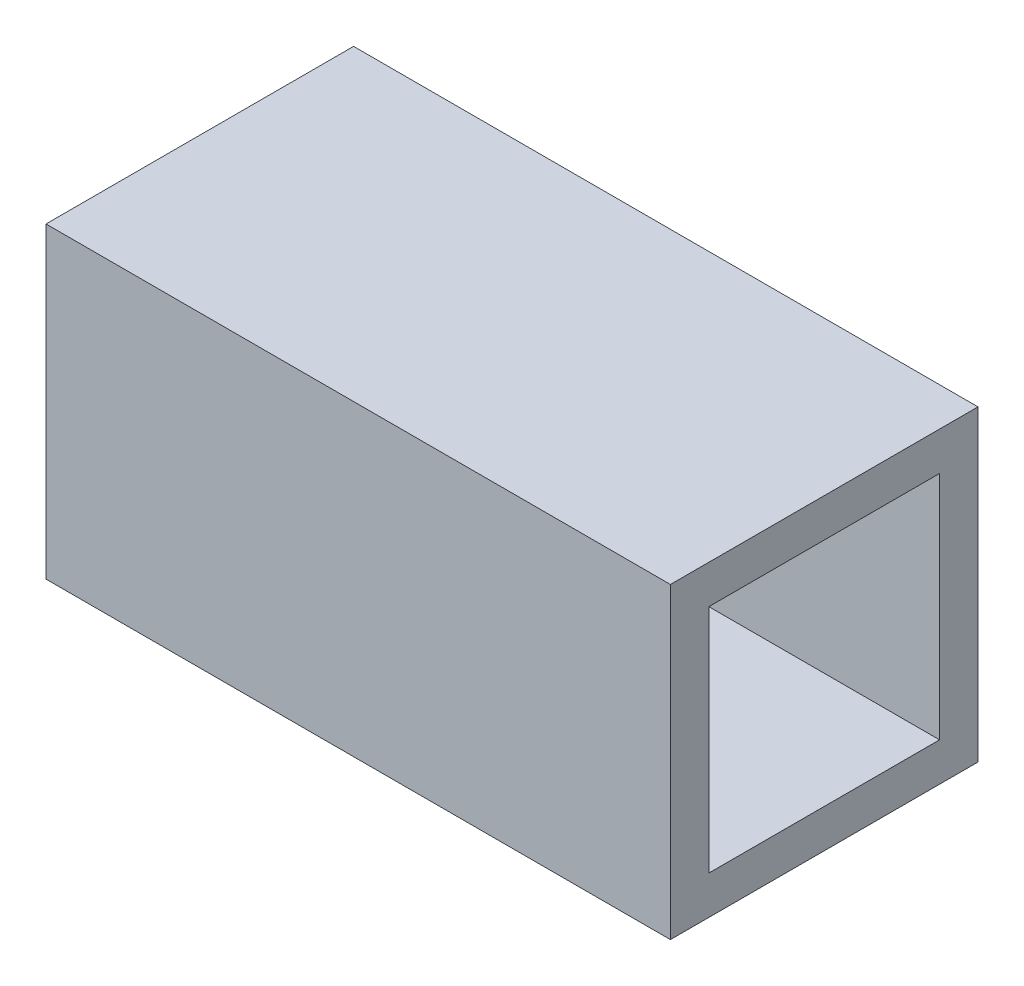
from build123d import *

# Parameters (mm, degrees)
SKETCH1_W           = 51.562
SKETCH1_H           = 25.4
BOSS_EXTRUDE1_DEPTH = 25.4
SKETCH2_W           = 19.05
SKETCH2_H           = 19.05
CUT_EXTRUDE1_DEPTH  = 63.840749868


with BuildPart() as part:
    # Sketch1 → Boss-Extrude1 (new body)
    with BuildSketch(Plane(origin=(0, 0, 0), x_dir=(1, 0, 0), z_dir=(0, 1, 0))):
        with Locations((25.781, 12.7)):
            Rectangle(SKETCH1_W, SKETCH1_H)
    extrude(amount=BOSS_EXTRUDE1_DEPTH)

    # Sketch2 → Cut-Extrude1 (cut, through all)
    with BuildSketch(Plane(origin=(51.562, 0, 0), x_dir=(0, 0, -1), z_dir=(1, 0, 0))):
        with Locations((12.7, 12.7)):
            Rectangle(SKETCH2_W, SKETCH2_H)
    extrude(amount=-CUT_EXTRUDE1_DEPTH, mode=Mode.SUBTRACT)


solid = part.part
